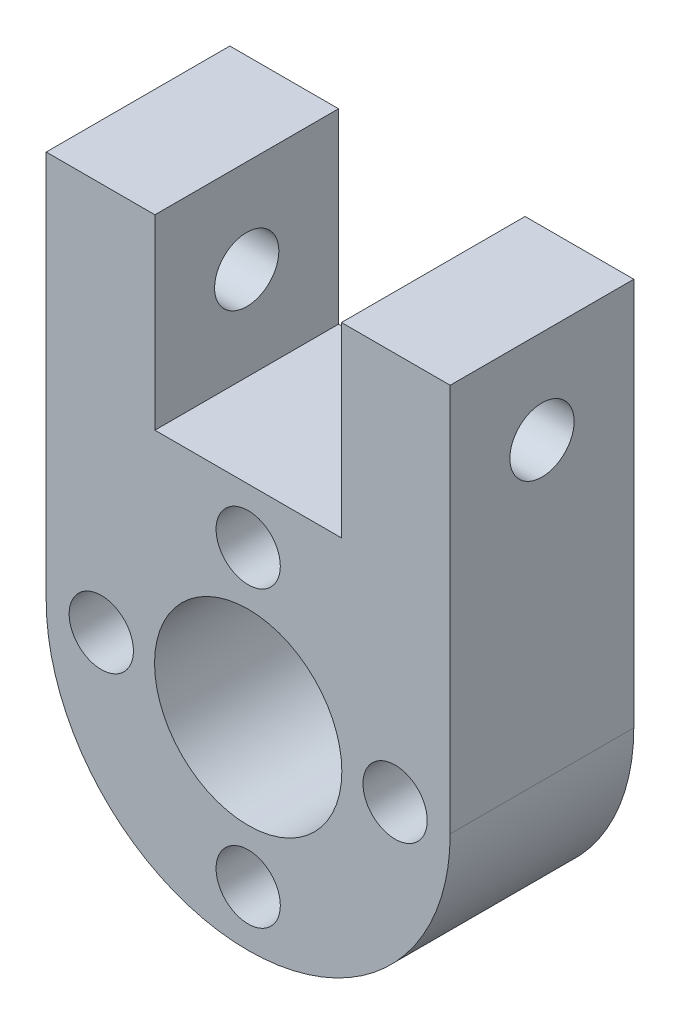
from build123d import *

# Parameters (mm, degrees)
SKETCH1_R           = 11
SKETCH1_R_2         = 5.1
BOSS_EXTRUDE1_DEPTH = 10
SKETCH2_R           = 1.75
CUT_EXTRUDE1_DEPTH  = 19.493242009
BOSS_EXTRUDE2_START = 11
SKETCH3_W           = 22
SKETCH3_H           = 10
BOSS_EXTRUDE2_DEPTH = 10.16
BOSS_EXTRUDE3_REACH = 28.552
SKETCH5_W           = 22
SKETCH5_H           = 10
SKETCH6_W           = 10.16
SKETCH6_H           = 10.16
CUT_EXTRUDE2_DEPTH  = 26.860116009
SKETCH7_R           = 1.75
CUT_EXTRUDE3_DEPTH  = 33.120797001


with BuildPart() as part:
    # Sketch1 → Boss-Extrude1 (new body)
    with BuildSketch(Plane.XY):
        Circle(SKETCH1_R)
        Circle(SKETCH1_R_2, mode=Mode.SUBTRACT)
    extrude(amount=BOSS_EXTRUDE1_DEPTH)

    # Sketch2 → Cut-Extrude1 (cut, through all)
    with BuildSketch(Plane.XY.offset(10)):
        with Locations((0, 8)):
            Circle(SKETCH2_R)
        with Locations((8, 0)):
            Circle(SKETCH2_R)
        with Locations((0, -8)):
            Circle(SKETCH2_R)
        with Locations((-8, 0)):
            Circle(SKETCH2_R)
    extrude(amount=-CUT_EXTRUDE1_DEPTH, mode=Mode.SUBTRACT)

    # Sketch5 → Boss-Extrude3 (add, up to next)
    with BuildSketch(Plane.XZ.offset(-11), mode=Mode.PRIVATE) as boss_extrude3_sk1:
        with Locations((0, 5)):
            Rectangle(SKETCH5_W, SKETCH5_H)
    boss_extrude3_tool1 = extrude(boss_extrude3_sk1.sketch, amount=BOSS_EXTRUDE3_REACH, mode=Mode.PRIVATE) - part.part


with BuildPart() as body_2:
    # Sketch3 → Boss-Extrude2 (new body)
    with BuildSketch(Plane(origin=(0, 0, 0), x_dir=(1, 0, 0), z_dir=(0, 1, 0)).offset(BOSS_EXTRUDE2_START)):
        with Locations((0, -5)):
            Rectangle(SKETCH3_W, SKETCH3_H)
    extrude(amount=BOSS_EXTRUDE2_DEPTH)


with BuildPart() as part_1:
    add(part.part)

    add(body_2.part)  # Boss-Extrude3 merges body 2
    add(boss_extrude3_tool1.solids().sort_by_distance((0, 11, 5))[0])
    add(boss_extrude3_tool1.solids().sort_by_distance((0, 11, 5))[1])

    # Sketch6 → Cut-Extrude2 (cut, through all)
    with BuildSketch(Plane.XY.offset(10)):
        with Locations((0, 16.08)):
            Rectangle(SKETCH6_W, SKETCH6_H)
    extrude(amount=-CUT_EXTRUDE2_DEPTH, mode=Mode.SUBTRACT)

    # Sketch7 → Cut-Extrude3 (cut, through all)
    with BuildSketch(Plane(origin=(11, 0, 0), x_dir=(0, 0, -1), z_dir=(1, 0, 0))):
        with Locations((-5, 16.08)):
            Circle(SKETCH7_R)
    extrude(amount=-CUT_EXTRUDE3_DEPTH, mode=Mode.SUBTRACT)


solid = part_1.part
